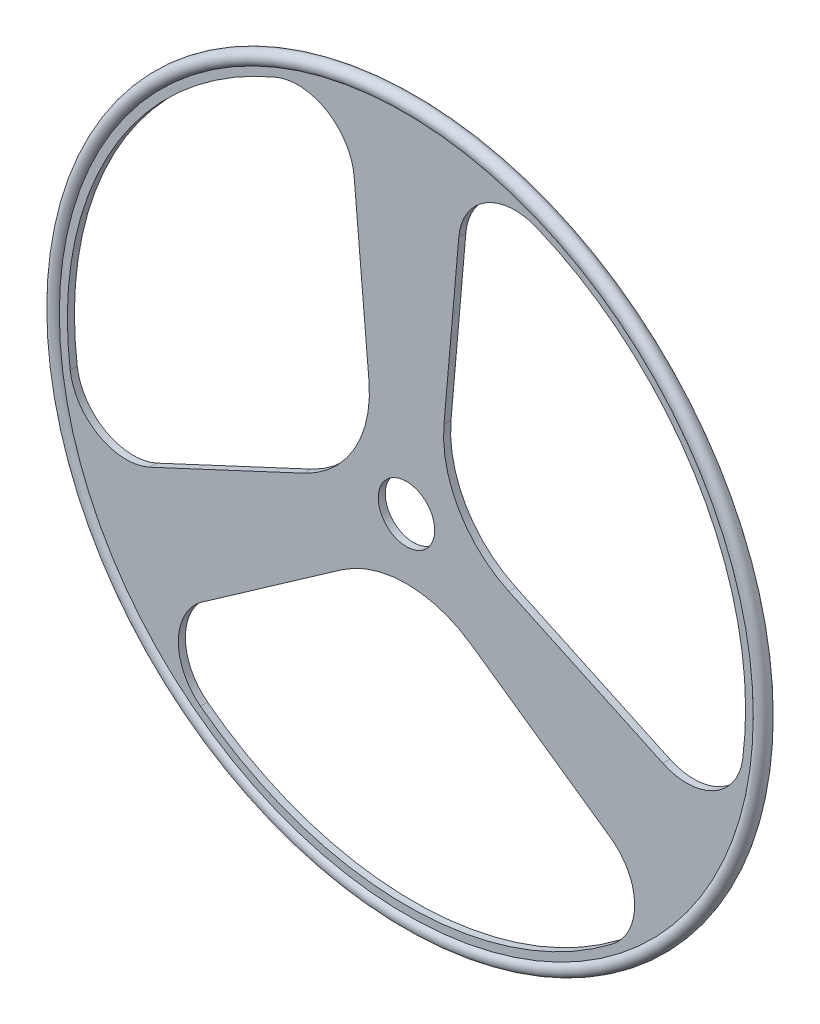
from build123d import *

# Parameters (mm, degrees)
BOSS_EXTRUDE1_DEPTH      = 2.5
BOSS_EXTRUDE1_DEPTH_BACK = 2.5
SKETCH1_R                = 20
BOSS_EXTRUDE2_DEPTH      = 2.5
BOSS_EXTRUDE2_DEPTH_BACK = 2.5
SKETCH1_7_R              = 250
SKETCH1_7_R_2            = 240
SKETCH3_R                = 5
FILLET1_R                = 80
FILLET2_R                = 80
FILLET3_R                = 80


with BuildPart() as part:
    # Sketch1 → Boss-Extrude1 (new, two sides: drawn at the far end of the back side and taken through both)
    with BuildSketch(Plane.XY.offset(-BOSS_EXTRUDE1_DEPTH_BACK)):
        with BuildLine():
            Line((0, -25), (144.414205762, -126.119915499))
            ThreePointArc((144.414205762, -126.119915499), (161.46238624, -158.048806347), (145.76537797, -190.663196725))
            ThreePointArc((145.76537797, -190.663196725), (207.846096908, -120), (238.001860915, -30.904921952))
            ThreePointArc((238.001860915, -30.904921952), (217.605474454, -60.806125066), (181.430153626, -62.006413108))
            Line((181.430153626, -62.006413108), (21.650635095, 12.5))
            Line((21.650635095, 12.5), (37.015947864, 188.126328607))
            ThreePointArc((37.015947864, 188.126328607), (56.143088214, 218.854931413), (92.236482946, 221.568118676))
            ThreePointArc((92.236482946, 221.568118676), (0, 240), (-92.236482946, 221.568118676))
            ThreePointArc((-92.236482946, 221.568118676), (-56.143088214, 218.854931413), (-37.015947864, 188.126328607))
            Line((-37.015947864, 188.126328607), (-21.650635095, 12.5))
            Line((-21.650635095, 12.5), (-181.430153626, -62.006413108))
            ThreePointArc((-181.430153626, -62.006413108), (-217.605474454, -60.806125066), (-238.001860915, -30.904921952))
            ThreePointArc((-238.001860915, -30.904921952), (-207.846096908, -120), (-145.76537797, -190.663196725))
            ThreePointArc((-145.76537797, -190.663196725), (-161.46238624, -158.048806347), (-144.414205762, -126.119915499))
            Line((-144.414205762, -126.119915499), (0, -25))
        make_face()
        Circle(SKETCH1_R, mode=Mode.SUBTRACT)
    extrude(amount=BOSS_EXTRUDE1_DEPTH + BOSS_EXTRUDE1_DEPTH_BACK)

    # Sketch1<7> → Boss-Extrude2 (add, two sides: drawn at the far end of the back side and taken through both)
    with BuildSketch(Plane.XY.offset(-BOSS_EXTRUDE2_DEPTH_BACK)):
        Circle(SKETCH1_7_R)
        Circle(SKETCH1_7_R_2, mode=Mode.SUBTRACT)
    extrude(amount=BOSS_EXTRUDE2_DEPTH + BOSS_EXTRUDE2_DEPTH_BACK)

    # Fillet1
    fillet1_edges = [part.edges().sort_by_distance(p)[0] for p in [
        (-21.650635095, 12.5, 0),
    ]]
    fillet(fillet1_edges, radius=FILLET1_R)

    # Fillet2
    fillet2_edges = [part.edges().sort_by_distance(p)[0] for p in [
        (21.650635095, 12.5, 0),
    ]]
    fillet(fillet2_edges, radius=FILLET2_R)

    # Fillet3
    fillet3_edges = [part.edges().sort_by_distance(p)[0] for p in [
        (0, -25, 0),
    ]]
    fillet(fillet3_edges, radius=FILLET3_R)


with BuildPart() as body_2:
    # Sketch3 → Revolve1 (revolve)
    with BuildSketch(Plane(origin=(0, 0, 0), x_dir=(0, 0, -1), z_dir=(1, 0, 0)), mode=Mode.PRIVATE) as revolve1_sk:
        with Locations((0, 250)):
            Circle(SKETCH3_R)
    revolve(revolve1_sk.sketch.rotate(Axis((0, 0, 0), (0, 0, -1)), 90), axis=Axis((0, 0, 0), (0, 0, -1)))


solid = Compound([part.part, body_2.part])
